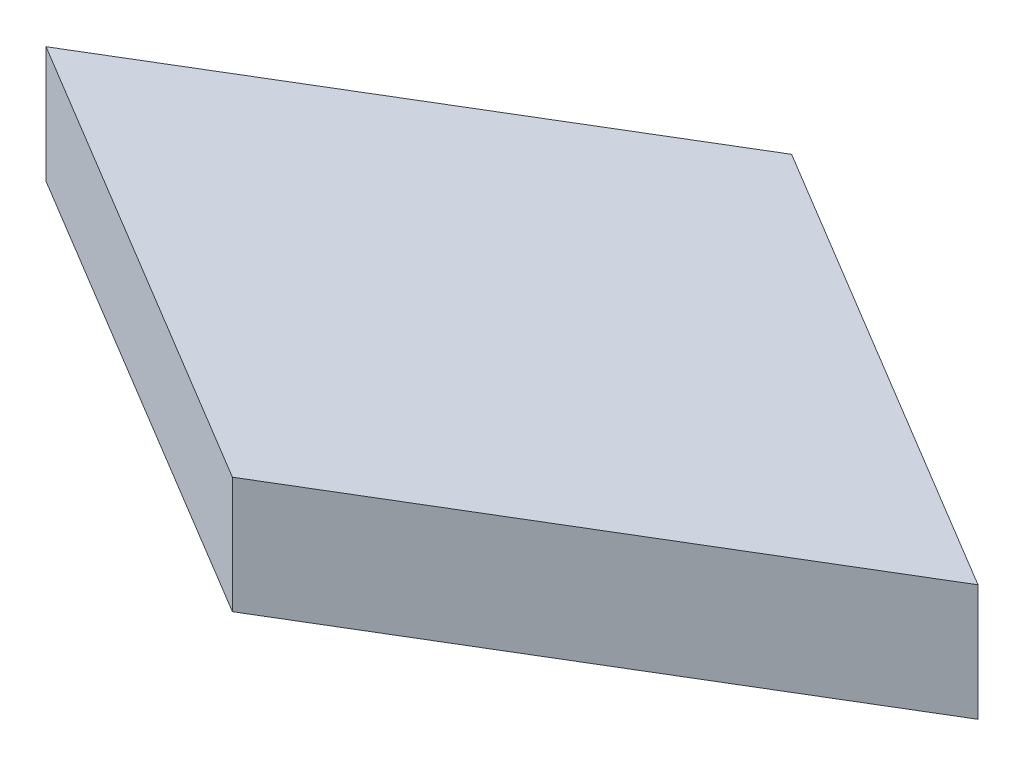
from build123d import *

# Parameters (mm, degrees)
EXTRUDE_1_DEPTH = 5


with BuildPart() as part:
    # 草图1 → 凸台-拉伸1 (new body)
    with BuildSketch(Plane(origin=(0, 0, 0), x_dir=(1, 0, 0), z_dir=(0, 1, 0))):
        Polygon((0, -12), (-20, 0), (0, 12), (20, 0), align=None)
    extrude(amount=EXTRUDE_1_DEPTH)


solid = part.part
